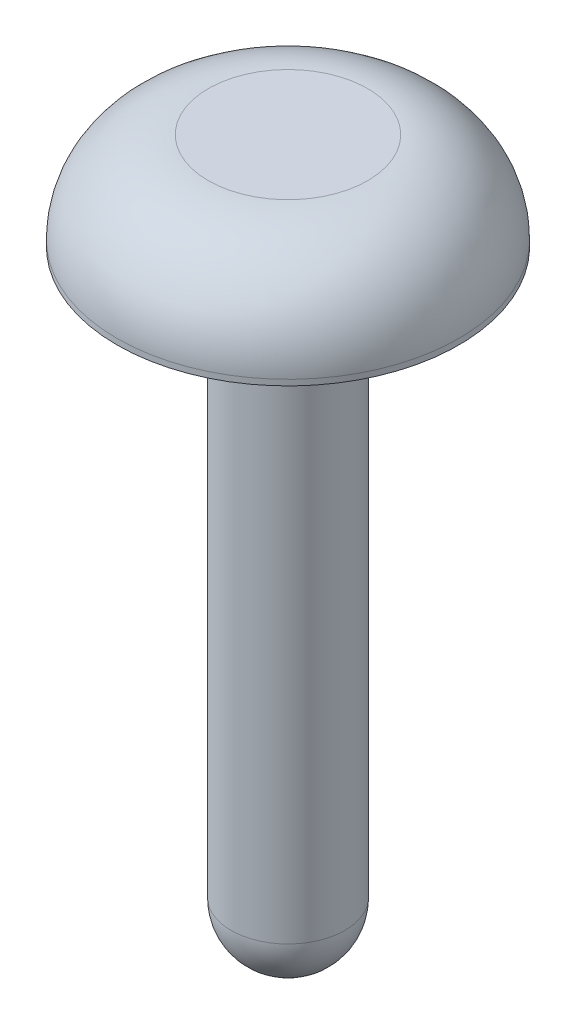
from build123d import *
from build123d.topology import SkipClean

# Parameters (mm, degrees)
CROQUIS2_R                   = 1
SALIENTE_EXTRUIR1_DEPTH      = 12.6
REDONDEO5_R                  = 1
SALIENTE_EXTRUIR2_DEPTH      = 0.0001
SALIENTE_EXTRUIR2_DEPTH_BACK = 1.7
CROQUIS3_R                   = 3
REDONDEO6_R                  = 1.6
CROQUIS4_R                   = 2.5
CROQUIS4_R_2                 = 1
CORTAR_EXTRUIR6_DEPTH        = 1


with BuildPart() as part:
    # Croquis2 → Saliente-Extruir1 (new body)
    with BuildSketch(Plane(origin=(0, 0, 0), x_dir=(1, 0, 0), z_dir=(0, 1, 0))):
        with Locations(Location((0, 0, 0), (0, 0, 270))):
            Circle(CROQUIS2_R)
    extrude(amount=SALIENTE_EXTRUIR1_DEPTH)

    # Redondeo5
    redondeo5_edges = [part.edges().sort_by_distance(p)[0] for p in [
        (0, 0, -1),
    ]]
    fillet(redondeo5_edges, radius=REDONDEO5_R)

    # Croquis3 → Saliente-Extruir2 (add, two sides: drawn at the far end of the back side and taken through both)
    with BuildSketch(Plane(origin=(0, 12.6, 0), x_dir=(1, 0, 0), z_dir=(0, 1, 0)).offset(-SALIENTE_EXTRUIR2_DEPTH_BACK)):
        with Locations(Location((0, 0, 0), (0, 0, 270))):
            Circle(CROQUIS3_R)
    extrude(amount=SALIENTE_EXTRUIR2_DEPTH + SALIENTE_EXTRUIR2_DEPTH_BACK)

    # Redondeo6
    redondeo6_edges = [part.edges().sort_by_distance(p)[0] for p in [
        (0, 12.6001, -3),
    ]]
    fillet(redondeo6_edges, radius=REDONDEO6_R)

    # Croquis4 → Cortar-Extruir6 (cut)
    with SkipClean():  # the faces are left unmerged after this step: merging them gives an invalid solid
        with BuildSketch(Plane(origin=(0, 10.9, 0), x_dir=(-1, 0, 0), z_dir=(0, -1, 0))):
            with Locations(Location((0, 0, 0), (0, 0, 90))):
                Circle(CROQUIS4_R)
            with Locations(Location((0, 0, 0), (0, 0, 90))):
                Circle(CROQUIS4_R_2, mode=Mode.SUBTRACT)
        extrude(amount=-CORTAR_EXTRUIR6_DEPTH, mode=Mode.SUBTRACT)


solid = part.part
